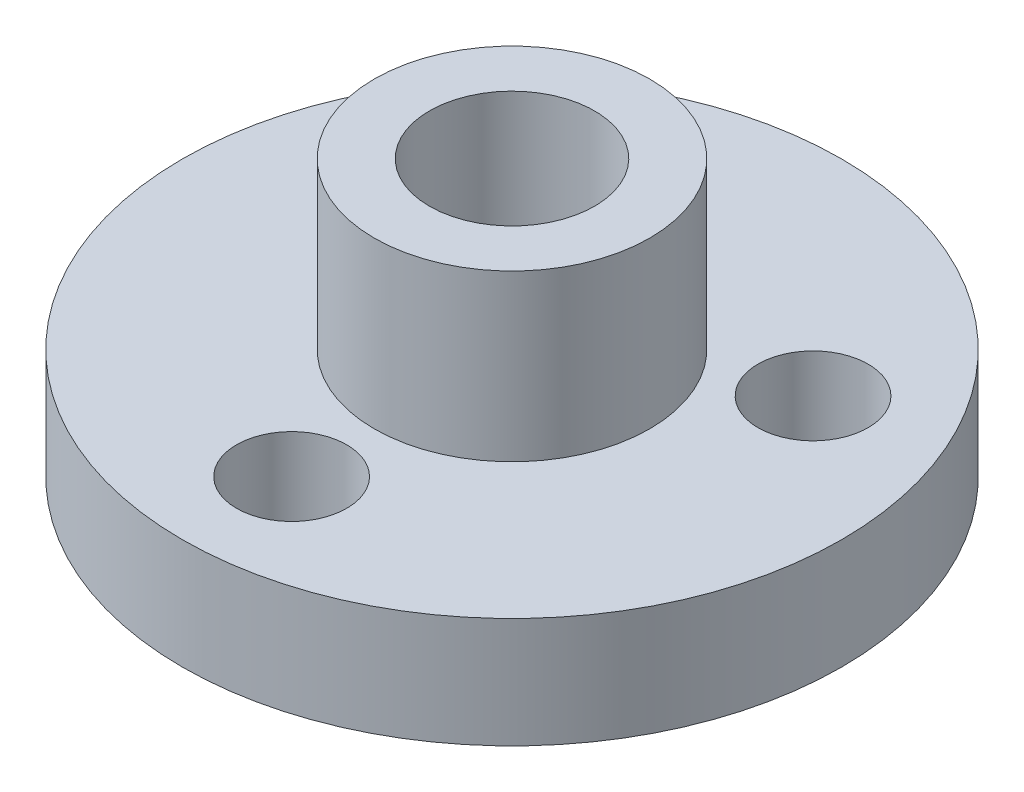
from build123d import *

# Parameters (mm, degrees)
SKETCH1_R           = 9.5
BOSS_EXTRUDE1_DEPTH = 3.18
SKETCH2_R           = 3.97
BOSS_EXTRUDE2_DEPTH = 4.76
SKETCH3_R           = 2.38
CUT_EXTRUDE1_DEPTH  = 16.605883506
SKETCH4_R           = 1.5875
CUT_EXTRUDE2_DEPTH  = 15.253336452


with BuildPart() as part:
    # Sketch1 → Boss-Extrude1 (new body)
    with BuildSketch(Plane(origin=(0, 0, 0), x_dir=(1, 0, 0), z_dir=(0, 1, 0))):
        with Locations(Location((0, 0, 0), (0, 0, 90))):
            Circle(SKETCH1_R)
    extrude(amount=BOSS_EXTRUDE1_DEPTH)

    # Sketch2 → Boss-Extrude2 (add)
    with BuildSketch(Plane(origin=(0, 3.18, 0), x_dir=(1, 0, 0), z_dir=(0, 1, 0))):
        with Locations(Location((0, 0, 0), (0, 0, 270))):
            Circle(SKETCH2_R)
    extrude(amount=BOSS_EXTRUDE2_DEPTH)

    # Sketch3 → Cut-Extrude1 (cut, through all)
    with BuildSketch(Plane(origin=(0, 7.94, 0), x_dir=(1, 0, 0), z_dir=(0, 1, 0))):
        with Locations(Location((0, 0, 0), (0, 0, 270))):
            Circle(SKETCH3_R)
    extrude(amount=-CUT_EXTRUDE1_DEPTH, mode=Mode.SUBTRACT)

    # Sketch4 → Cut-Extrude2 (cut, through all)
    with BuildSketch(Plane(origin=(0, 3.18, 0), x_dir=(1, 0, 0), z_dir=(0, 1, 0))):
        with Locations(Location((0, -6.35, 0), (0, 0, 270))):
            Circle(SKETCH4_R)
        with Locations(Location((-5.499261314, 3.175, 0), (0, 0, 270))):
            Circle(SKETCH4_R)
        with Locations(Location((5.499261314, 3.175, 0), (0, 0, 270))):
            Circle(SKETCH4_R)
    extrude(amount=-CUT_EXTRUDE2_DEPTH, mode=Mode.SUBTRACT)


solid = part.part
